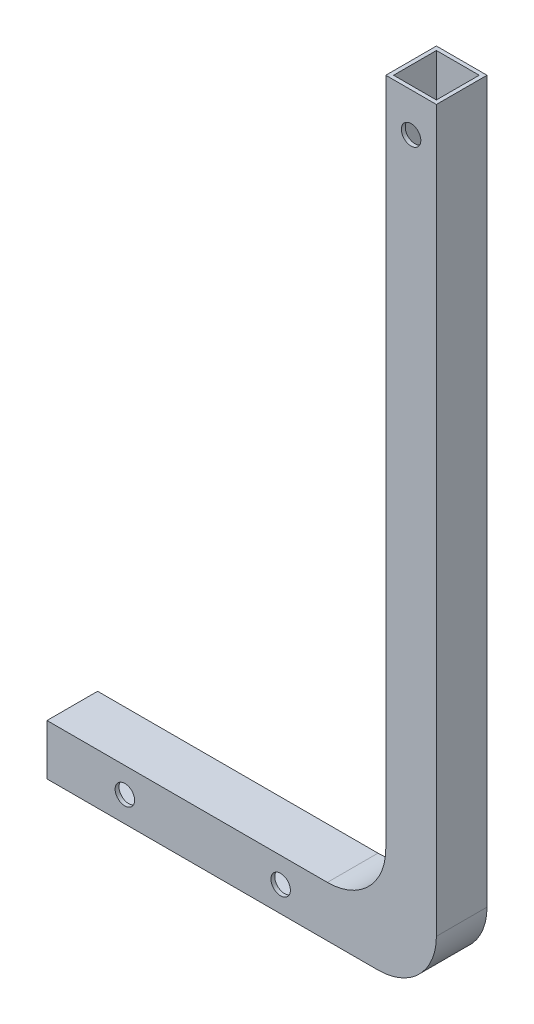
from build123d import *

# Parameters (mm, degrees)
BOSS_EXTRUDE1_DEPTH = 33.02
SHELL1_T            = -2.54
CUT_EXTRUDE1_REACH  = 570.92
SKETCH2_W           = 27.94
SKETCH2_H           = 27.94
SKETCH3_R           = 6.35
CUT_EXTRUDE2_DEPTH  = 540.640918389
SKETCH4_R           = 6.35
CUT_EXTRUDE3_DEPTH  = 540.640918389


with BuildPart() as part:
    # Sketch1 → Boss-Extrude1 (new body)
    with BuildSketch(Plane.XY):
        with BuildLine():
            Line((0, 0), (0, -33.02))
            Line((0, -33.02), (215.9, -33.02))
            ThreePointArc((215.9, -33.02), (242.840768363, -21.860768363), (254, 5.08))
            Line((254, 5.08), (254, 474.98))
            Line((254, 474.98), (220.98, 474.98))
            Line((220.98, 474.98), (220.98, 38.1))
            ThreePointArc((220.98, 38.1), (209.820768363, 11.159231637), (182.88, 0))
            Line((182.88, 0), (0, 0))
        make_face()
    extrude(amount=BOSS_EXTRUDE1_DEPTH)

    # Shell1
    shell1_openings = [part.faces().sort_by_distance(p)[0] for p in [
        (0, -16.51, 16.51),
    ]]
    offset(amount=SHELL1_T, openings=shell1_openings, kind=Kind.INTERSECTION)

    # Sketch2 → Cut-Extrude1 (cut, up to next)
    with BuildSketch(Plane(origin=(0, 474.98, 0), x_dir=(1, 0, 0), z_dir=(0, 1, 0)), mode=Mode.PRIVATE) as cut_extrude1_sk1:
        with Locations((237.49, -16.51)):
            Rectangle(SKETCH2_W, SKETCH2_H)
    cut_extrude1_tool1 = extrude(cut_extrude1_sk1.sketch, amount=-CUT_EXTRUDE1_REACH, mode=Mode.PRIVATE) & part.part
    add(cut_extrude1_tool1.solids().sort_by_distance((237.49, 474.98, 16.51))[0], mode=Mode.SUBTRACT)

    # Sketch3 → Cut-Extrude2 (cut, through all)
    with BuildSketch(Plane.XY.offset(33.02)):
        with Locations((50.8, -16.51)):
            Circle(SKETCH3_R)
        with Locations((152.4, -16.51)):
            Circle(SKETCH3_R)
    extrude(amount=-CUT_EXTRUDE2_DEPTH, mode=Mode.SUBTRACT)

    # Sketch4 → Cut-Extrude3 (cut, through all)
    with BuildSketch(Plane.XY.offset(33.02)):
        with Locations((237.49, 449.58)):
            Circle(SKETCH4_R)
    extrude(amount=-CUT_EXTRUDE3_DEPTH, mode=Mode.SUBTRACT)


solid = part.part
